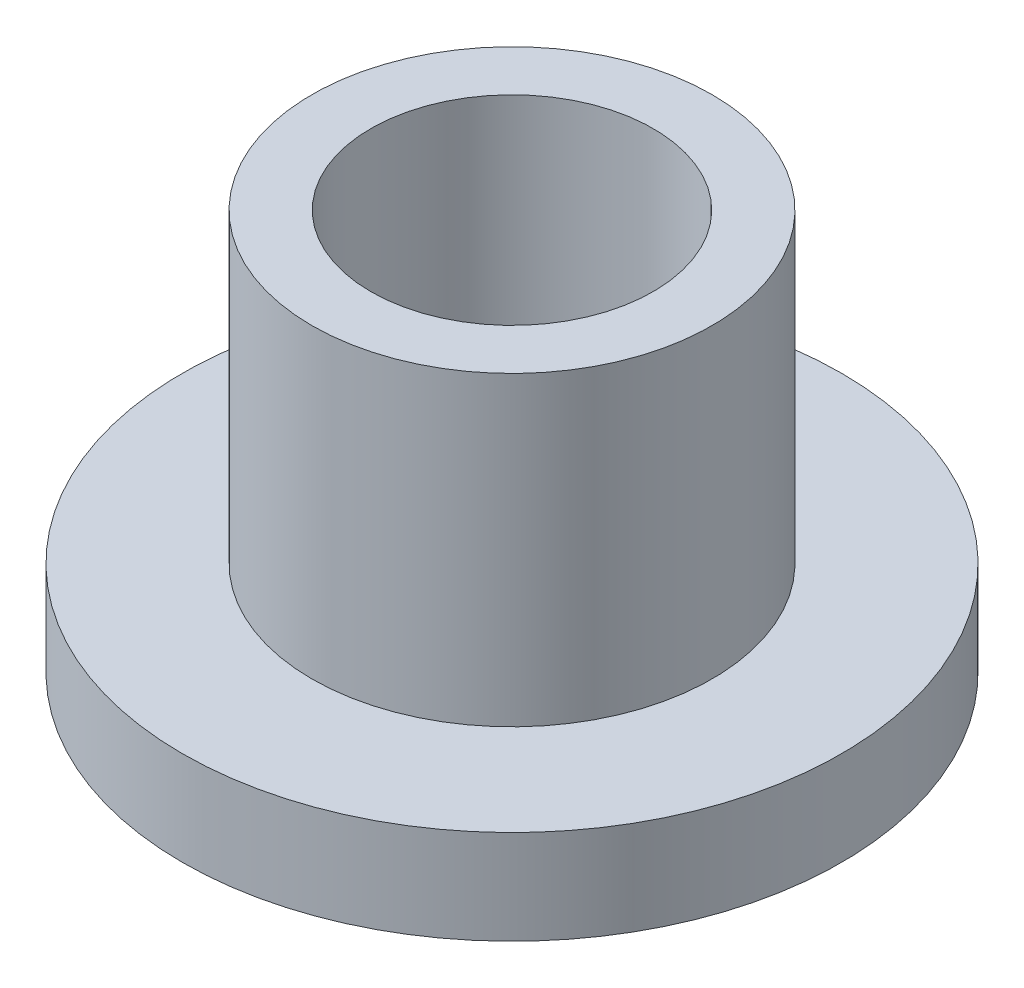
from build123d import *

# Parameters (mm, degrees)
SKETCH_1_R          = 7
EXTRUDE_1_DEPTH     = 2
SKETCH_2_R          = 4.25
EXTRUDE_2_DEPTH     = 6.5
CUT_EXTRUDE_1_REACH = 15.048
SKETCH_3_R          = 3


with BuildPart() as part:
    # 草图1 → 凸台-拉伸1 (new body)
    with BuildSketch(Plane(origin=(0, 0, 0), x_dir=(1, 0, 0), z_dir=(0, 1, 0))):
        with Locations(Location((0, 0, 0), (0, 0, 270))):
            Circle(SKETCH_1_R)
    extrude(amount=EXTRUDE_1_DEPTH)

    # 草图2 → 凸台-拉伸2 (add)
    with BuildSketch(Plane(origin=(0, 2, 0), x_dir=(1, 0, 0), z_dir=(0, 1, 0))):
        with Locations(Location((0, 0, 0), (0, 0, 90))):
            Circle(SKETCH_2_R)
    extrude(amount=EXTRUDE_2_DEPTH)

    # 草图3 → 切除-拉伸1 (cut, up to next)
    with BuildSketch(Plane(origin=(0, 8.5, 0), x_dir=(1, 0, 0), z_dir=(0, 1, 0)), mode=Mode.PRIVATE) as cut_extrude_1_sk1:
        with Locations(Location((0, 0, 0), (0, 0, 270))):
            Circle(SKETCH_3_R)
    cut_extrude_1_tool1 = extrude(cut_extrude_1_sk1.sketch, amount=-CUT_EXTRUDE_1_REACH, mode=Mode.PRIVATE) & part.part
    add(cut_extrude_1_tool1.solids().sort_by_distance((0, 8.5, 0))[0], mode=Mode.SUBTRACT)


solid = part.part
